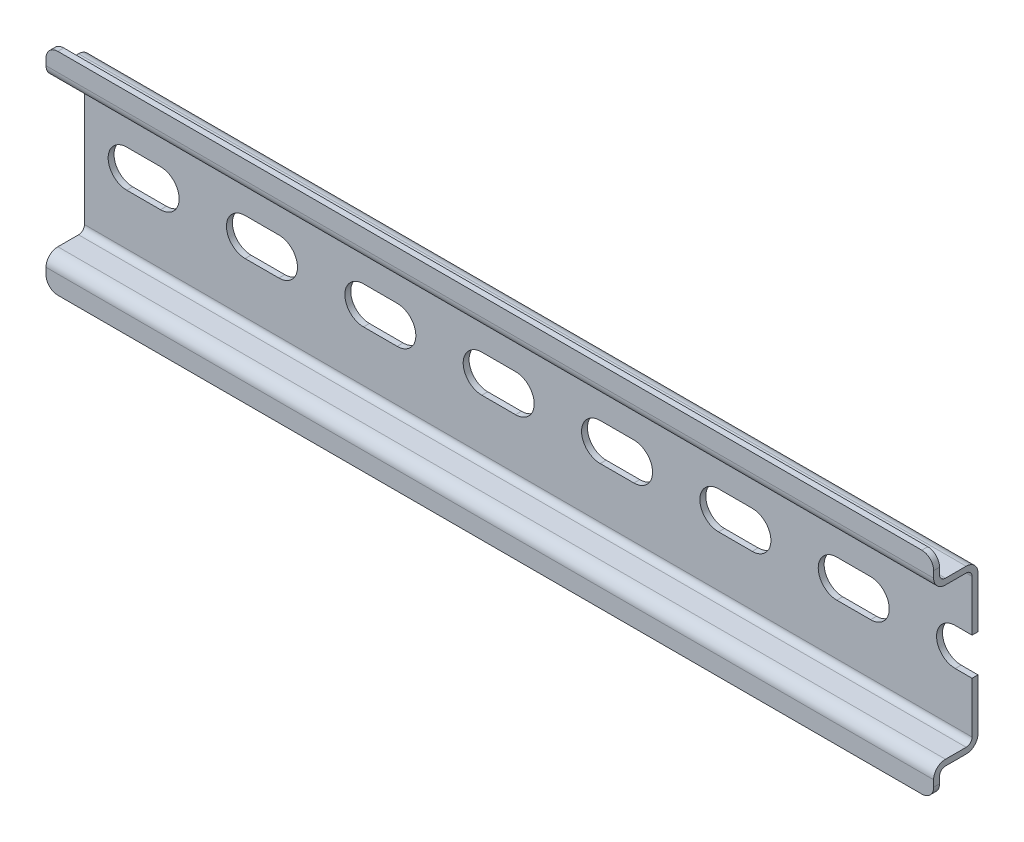
from build123d import *

# Parameters (mm, degrees)
BOSS_EXTRUDE1_DEPTH = 150
CUT_EXTRUDE1_DEPTH  = 155.372082968
LPATTERN1_COUNT     = 8
LPATTERN1_PITCH     = 20
FILLET1_R           = 2


with BuildPart() as part:
    # Sketch1 → Boss-Extrude1 (new body)
    with BuildSketch(Plane(origin=(0, 0, 0), x_dir=(0, 0, -1), z_dir=(1, 0, 0))):
        with BuildLine():
            Line((0, 0), (0, 3.1))
            ThreePointArc((0, 3.1), (0.585786438, 4.514213562), (2, 5.1))
            Line((2, 5.1), (5.5, 5.1))
            ThreePointArc((5.5, 5.1), (6.207106781, 5.392893219), (6.5, 6.1))
            Line((6.5, 6.1), (6.5, 29.6))
            ThreePointArc((6.5, 29.6), (6.207106781, 30.307106781), (5.5, 30.6))
            Line((5.5, 30.6), (2, 30.6))
            ThreePointArc((2, 30.6), (0.585786438, 31.185786438), (0, 32.6))
            Line((0, 32.6), (0, 35.7))
            Line((0, 35.7), (1, 35.7))
            Line((1, 35.7), (1, 32.6))
            ThreePointArc((1, 32.6), (1.292893219, 31.892893219), (2, 31.6))
            Line((2, 31.6), (5.5, 31.6))
            ThreePointArc((5.5, 31.6), (6.914213562, 31.014213562), (7.5, 29.6))
            Line((7.5, 29.6), (7.5, 6.1))
            ThreePointArc((7.5, 6.1), (6.914213562, 4.685786438), (5.5, 4.1))
            Line((5.5, 4.1), (2, 4.1))
            ThreePointArc((2, 4.1), (1.292893219, 3.807106781), (1, 3.1))
            Line((1, 3.1), (1, 0))
            Line((1, 0), (0, 0))
        make_face()
    extrude(amount=BOSS_EXTRUDE1_DEPTH)

    # Sketch2 → Cut-Extrude1 (cut, through all)
    with BuildSketch(Plane.XY):
        with BuildLine():
            Line((7.15, 21), (12.85, 21))
            ThreePointArc((12.85, 21), (16, 17.85), (12.85, 14.7))
            Line((12.85, 14.7), (7.15, 14.7))
            ThreePointArc((7.15, 14.7), (4, 17.85), (7.15, 21))
        make_face()
    cut_extrude1 = extrude(amount=-CUT_EXTRUDE1_DEPTH, mode=Mode.SUBTRACT)

    # LPattern1: Cut-Extrude1 ×8
    with Locations(*[(i * LPATTERN1_PITCH, 0, 0) for i in range(1, LPATTERN1_COUNT)]):
        add(cut_extrude1, mode=Mode.SUBTRACT)

    # Fillet1
    fillet1_edges = [part.edges().sort_by_distance(p)[0] for p in [
        (0, 35.7, -0.5),
        (0, 0, -0.5),
        (150, 35.7, -0.5),
        (150, 0, -0.5),
    ]]
    fillet(fillet1_edges, radius=FILLET1_R)


solid = part.part
